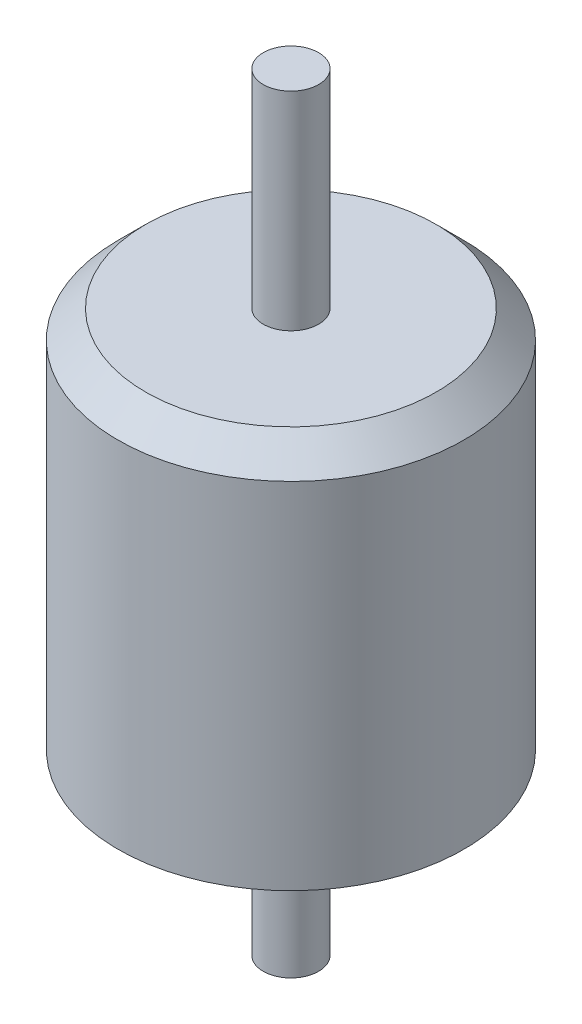
from build123d import *


with BuildPart() as part:
    # Sketch1 → Revolve1 (revolve)
    with BuildSketch(Plane.XY, mode=Mode.PRIVATE) as revolve1_sk:
        Polygon((0, 0), (4, 0), (4, 16), (7, 16), (7, 20), (15, 20), (25, 25.773502692), (25, 77), (21, 81), (4, 81), (4, 111), (0, 111), align=None)
    revolve(revolve1_sk.sketch.rotate(Axis((0, 111, 0), (0, -1, 0)), 180), axis=Axis((0, 111, 0), (0, -1, 0)))


solid = part.part
